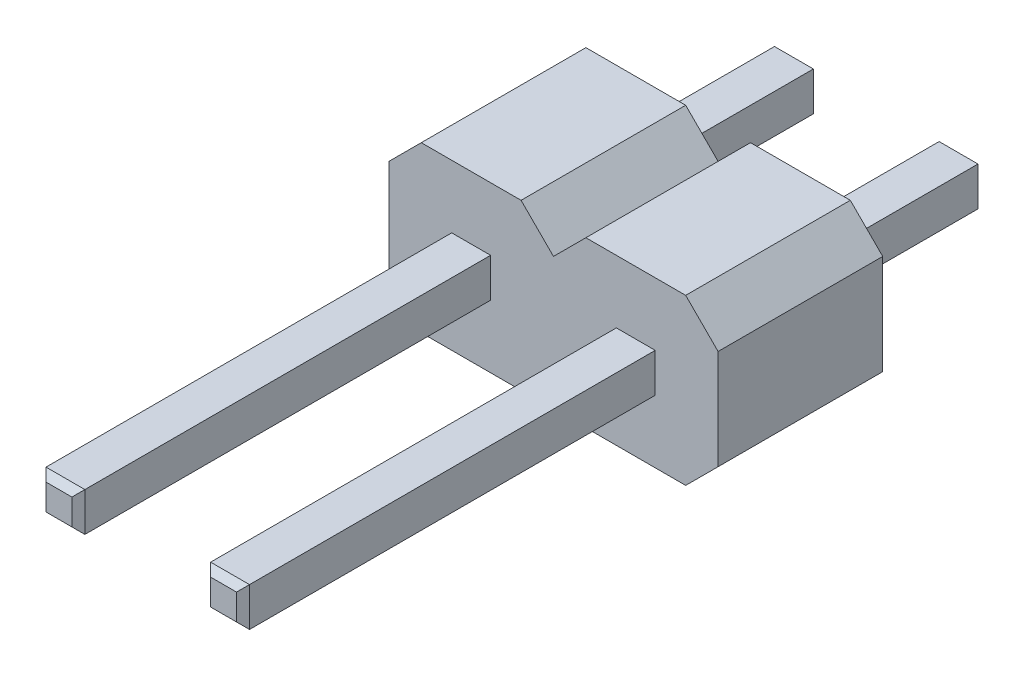
from build123d import *

# Parameters (mm, degrees)
PLASTIC_DEPTH                     = 2.54
SKETCH2_W                         = 11.44
SKETCH2_H                         = 0.6
CONTACT_DEPTH                     = 0.3
CHAMFER1_SIZE                     = 0.1
PATTERN_LINEAR_1_COUNT            = 2
PATTERN_LINEAR_1_PITCH            = 2.54
CHAMFER1_OF_PATTERN_LINEAR_1_SIZE = 0.1


with BuildPart() as part:
    # Sketch1 → Plastic (new body)
    with BuildSketch(Plane.XY):
        Polygon((-0.77, 1.27), (0.77, 1.27), (1.27, 0.77), (1.27, -0.77), (0.77, -1.27), (-0.77, -1.27), (-1.27, -0.77), (-1.27, 0.77), align=None)
    plastic = extrude(amount=PLASTIC_DEPTH)

    # Sketch2 → Contact (add, symmetric)
    with BuildSketch(Plane(origin=(0, 0, 0), x_dir=(0, 0, -1), z_dir=(1, 0, 0))):
        with Locations((-3.18, 0)):
            Rectangle(SKETCH2_W, SKETCH2_H)
    contact = extrude(amount=CONTACT_DEPTH, both=True)

    # Chamfer1
    chamfer1_edges = [part.edges().sort_by_distance(p)[0] for p in [
        (0, -0.3, 8.9),
        (0.3, 0, 8.9),
        (-0.3, 0, -2.54),
        (0, -0.3, -2.54),
        (0, 0.3, -2.54),
        (-0.3, 0, 8.9),
        (0, 0.3, 8.9),
        (0.3, 0, -2.54),
    ]]
    chamfer(chamfer1_edges, length=CHAMFER1_SIZE)

    # Линейный массив1: Plastic, Contact ×2
    with Locations(*[(i * PATTERN_LINEAR_1_PITCH, 0, 0) for i in range(1, PATTERN_LINEAR_1_COUNT)]):
        add(plastic)
        add(contact)

    # Chamfer1 of Линейный массив1
    chamfer1_of_pattern_linear_1_edges = [part.edges().sort_by_distance(p)[0] for p in [
        (2.54, -0.3, 8.9),
        (2.84, 0, 8.9),
        (2.24, 0, -2.54),
        (2.54, -0.3, -2.54),
        (2.54, 0.3, -2.54),
        (2.24, 0, 8.9),
        (2.54, 0.3, 8.9),
        (2.84, 0, -2.54),
    ]]
    chamfer(chamfer1_of_pattern_linear_1_edges, length=CHAMFER1_OF_PATTERN_LINEAR_1_SIZE)


solid = part.part
